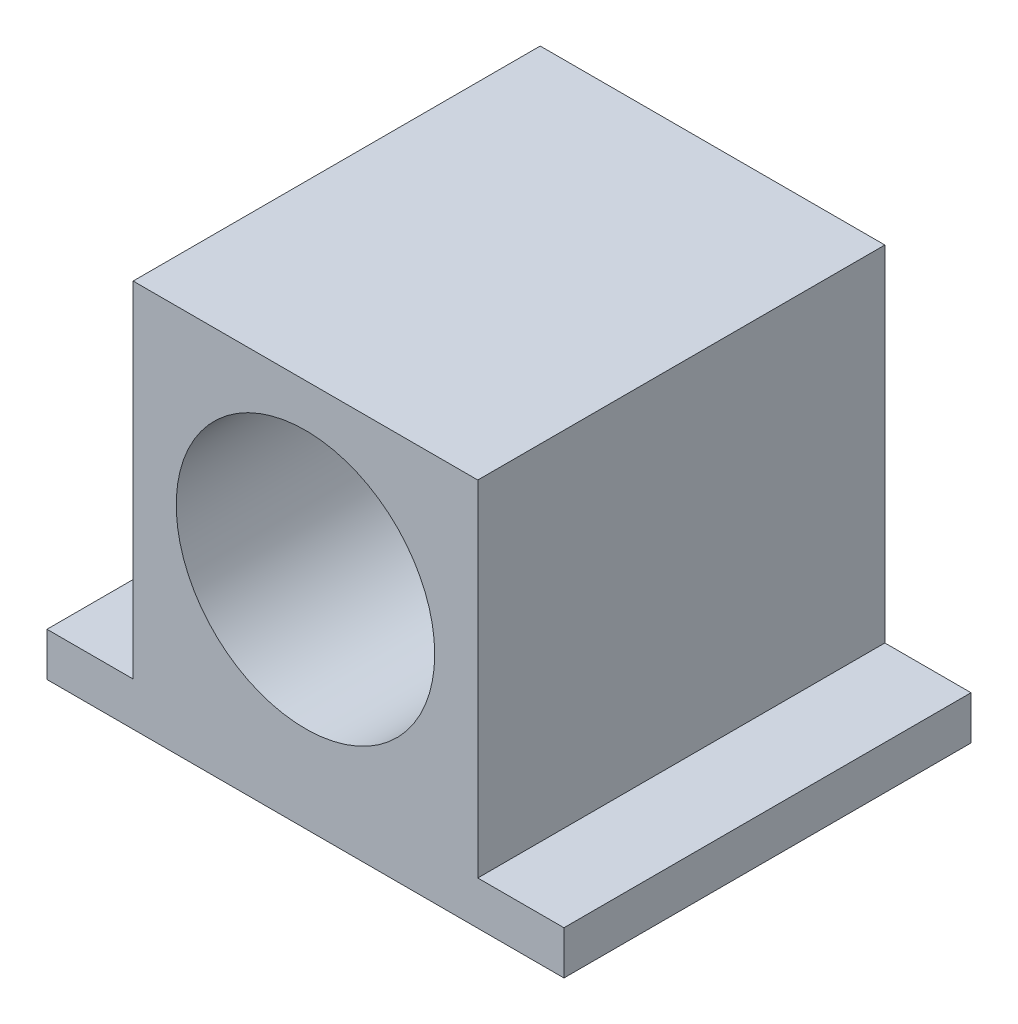
from build123d import *

# Parameters (mm, degrees)
SKETCH1_R           = 9.525
BOSS_EXTRUDE1_DEPTH = 30


with BuildPart() as part:
    # Sketch1 → Boss-Extrude1 (new body)
    with BuildSketch(Plane.XY):
        Polygon((12.7, -12.7), (12.7, 12.7), (-12.7, 12.7), (-12.7, -12.7), (-19.05, -12.7), (-19.05, -15.9079946), (19.05, -15.9079946), (19.05, -12.7), align=None)
        Circle(SKETCH1_R, mode=Mode.SUBTRACT)
    extrude(amount=BOSS_EXTRUDE1_DEPTH)


solid = part.part
